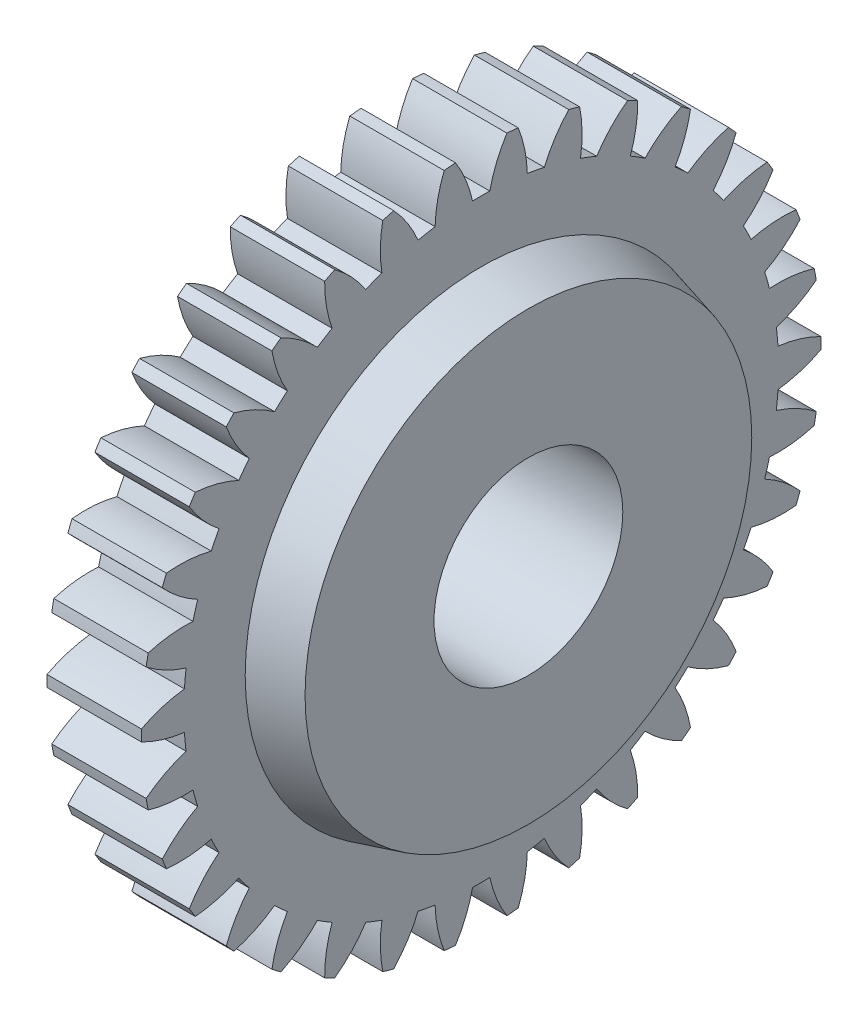
from build123d import *

# Parameters (mm, degrees)
BASPROSKE_W         = 3
BASPROSKE_H         = 10.8
TOOTHCUT_DEPTH      = 16.565346125
TEETHCUTS_COUNT     = 34
TEETHCUTS_ANGLE     = 349.411764706
SKETCH1_R           = 7.5
BOSS_EXTRUDE1_DEPTH = 1.5
BOSS_EXTRUDE1_TAPER = 15
BORSKE_R            = 3
BORE_DEPTH          = 50.0004064


with BuildPart() as part:
    # BasProSke → Base-Revolve (revolve)
    with BuildSketch(Plane(origin=(0, 0, 0), x_dir=(1, 0, 0), z_dir=(0, 1, 0)), mode=Mode.PRIVATE) as base_revolve_sk:
        with Locations((1.5, 5.4)):
            Rectangle(BASPROSKE_W, BASPROSKE_H)
    revolve(base_revolve_sk.sketch.rotate(Axis((-10, 0, 0), (1, 0, 0)), 180), axis=Axis((-10, 0, 0), (1, 0, 0)))

    # TooCutSke → ToothCut (cut, through all)
    with BuildSketch(Plane(origin=(0, 0, 0), x_dir=(0, 0, -1), z_dir=(1, 0, 0))):
        with BuildLine():
            ThreePointArc((0.275128483, 9.444993664), (0, 9.449), (-0.275128483, 9.444993664))
            ThreePointArc((-0.275128483, 9.444993664), (-0.493283593, 10.14429026), (-0.832969298, 10.793305671))
            ThreePointArc((-0.832969298, 10.793305671), (0, 10.8254), (0.832969298, 10.793305671))
            ThreePointArc((0.832969298, 10.793305671), (0.493283593, 10.14429026), (0.275128483, 9.444993664))
        make_face()
    toothcut = extrude(amount=TOOTHCUT_DEPTH, mode=Mode.SUBTRACT)

    # TeethCuts: ToothCut ×34 about axis
    teethcuts_axis = Axis((-10, 0, 0), (1, 0, 0))
    for i in range(1, TEETHCUTS_COUNT):
        add(toothcut.rotate(teethcuts_axis, i * TEETHCUTS_ANGLE / (TEETHCUTS_COUNT - 1)), mode=Mode.SUBTRACT)

    # Sketch1 → Boss-Extrude1 (add)
    with BuildSketch(Plane(origin=(3, 0, 0), x_dir=(0, 0, -1), z_dir=(1, 0, 0))):
        Circle(SKETCH1_R)
    extrude(amount=BOSS_EXTRUDE1_DEPTH, taper=BOSS_EXTRUDE1_TAPER)

    # BorSke → Bore (cut, symmetric)
    with BuildSketch(Plane(origin=(0, 0, 0), x_dir=(0, 0, -1), z_dir=(1, 0, 0))):
        Circle(BORSKE_R)
    extrude(amount=BORE_DEPTH, both=True, mode=Mode.SUBTRACT)


solid = part.part
